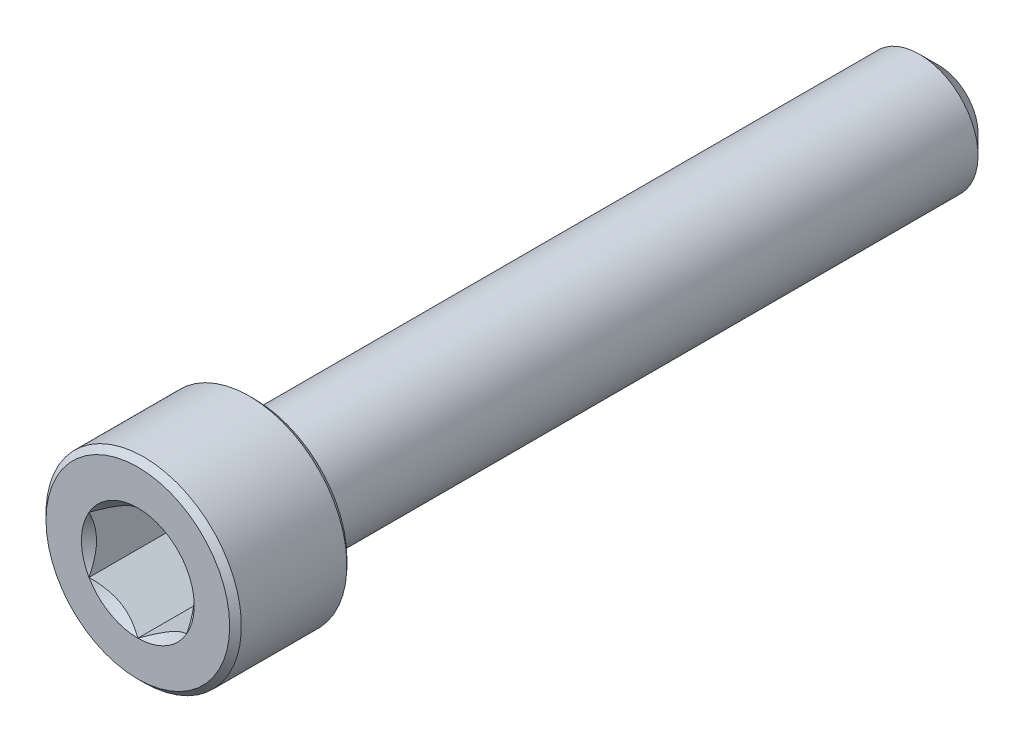
from build123d import *

# Parameters (mm, degrees)
CUT_EXTRUDE1_DEPTH = 5


with BuildPart() as part:
    # Sketch2 → Revolve1 (revolve)
    with BuildSketch(Plane(origin=(0, 0, 0), x_dir=(0, 0, -1), z_dir=(1, 0, 0))):
        Polygon((-20.5, 0), (-20.5, 4.7), (-20.2, 5), (-14.8, 5), (-14.5, 4.7), (-14.5, 3), (19.5, 3), (20.5, 2), (20.5, 0), align=None)
    revolve(axis=Axis((0, 0, -20.5), (0, 0, 1)))

    # Sketch3 → Cut-Extrude1 (cut)
    with BuildSketch(Plane.XY.offset(20.5)):
        Polygon((2.5, -1.443375673), (2.5, 1.443375673), (0, 2.886751346), (-2.5, 1.443375673), (-2.5, -1.443375673), (0, -2.886751346), align=None)
    extrude(amount=-CUT_EXTRUDE1_DEPTH, mode=Mode.SUBTRACT)

    # Cut-Extrude2 cone 1 section (through the dimple's axis) → Cut-Extrude2 (revolve, cut)
    with BuildSketch(Plane(origin=(0, 0, 20.5), x_dir=(0, -1, 0), z_dir=(1, 0, 0))):
        Polygon((0, 0), (2.886751346, 0), (0, 2.886751346), align=None)
    revolve(axis=Axis((0, 0, 20.5), (0, 0, -1)), mode=Mode.SUBTRACT)


solid = part.part
